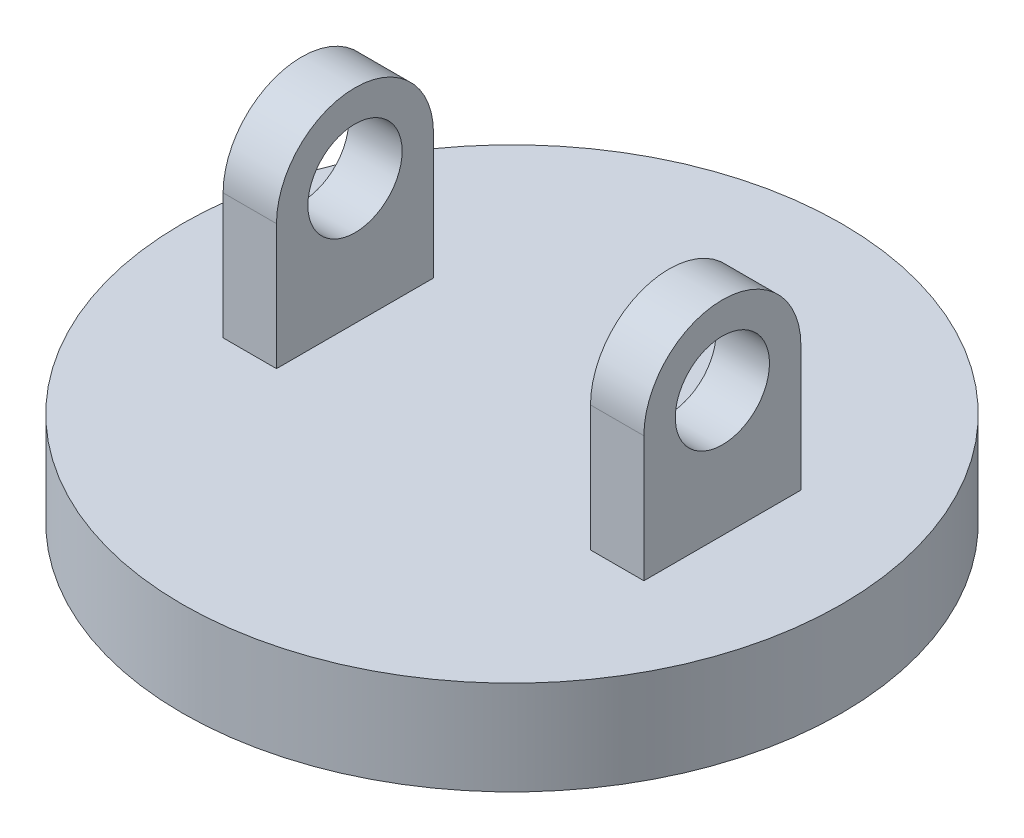
from build123d import *

# Parameters (mm, degrees)
SKETCH3_R           = 266.7
BOSS_EXTRUDE1_DEPTH = 76.2
SKETCH4_R           = 241.3
SKETCH4_R_2         = 215.9
CUT_EXTRUDE1_DEPTH  = 25.4
SKETCH5_R           = 254
SKETCH5_R_2         = 203.2
CUT_EXTRUDE2_DEPTH  = 25.4
SKETCH6_W           = 43.18
SKETCH6_H           = 127
BOSS_EXTRUDE2_DEPTH = 101.6
BOSS_EXTRUDE3_START = -43.18
BOSS_EXTRUDE3_DEPTH = 43.18
BOSS_EXTRUDE4_DEPTH = 43.18
SKETCH7_R           = 38.1
CUT_EXTRUDE3_DEPTH  = 566.878709972


with BuildPart() as part:
    # Sketch3 → Boss-Extrude1 (new body)
    with BuildSketch(Plane(origin=(0, 0, 0), x_dir=(1, 0, 0), z_dir=(0, 1, 0))):
        with Locations(Location((0, 0, 0), (0, 0, 90))):
            Circle(SKETCH3_R)
    extrude(amount=BOSS_EXTRUDE1_DEPTH)

    # Sketch4 → Cut-Extrude1 (cut)
    with BuildSketch(Plane.XZ):
        with Locations(Location((0, 0, 0), (0, 0, 270))):
            Circle(SKETCH4_R)
        with Locations(Location((0, 0, 0), (0, 0, 270))):
            Circle(SKETCH4_R_2, mode=Mode.SUBTRACT)
    extrude(amount=-CUT_EXTRUDE1_DEPTH, mode=Mode.SUBTRACT)

    # Sketch5 → Cut-Extrude2 (cut)
    with BuildSketch(Plane.XZ.offset(-25.4)):
        with Locations(Location((0, 0, 0), (0, 0, 270))):
            Circle(SKETCH5_R)
        with Locations(Location((0, 0, 0), (0, 0, 270))):
            Circle(SKETCH5_R_2, mode=Mode.SUBTRACT)
    extrude(amount=-CUT_EXTRUDE2_DEPTH, mode=Mode.SUBTRACT)

    # Sketch6 → Boss-Extrude2 (add)
    with BuildSketch(Plane(origin=(0, 76.2, 0), x_dir=(1, 0, 0), z_dir=(0, 1, 0))):
        with Locations((148.59, 0)):
            Rectangle(SKETCH6_W, SKETCH6_H)
        with Locations((-148.59, 0)):
            Rectangle(SKETCH6_W, SKETCH6_H)
    extrude(amount=BOSS_EXTRUDE2_DEPTH)

    # Sketch8 → Boss-Extrude3 (add)
    with BuildSketch(Plane.ZY.offset(170.18).offset(BOSS_EXTRUDE3_START)):
        with BuildLine():
            Line((-63.5, 177.8), (63.5, 177.8))
            ThreePointArc((63.5, 177.8), (0, 241.3), (-63.5, 177.8))
        make_face()
    extrude(amount=BOSS_EXTRUDE3_DEPTH)

    # Sketch10 → Boss-Extrude4 (add)
    with BuildSketch(Plane(origin=(170.18, 0, 0), x_dir=(0, 0, -1), z_dir=(1, 0, 0))):
        with BuildLine():
            Line((63.5, 177.8), (-63.5, 177.8))
            ThreePointArc((-63.5, 177.8), (0, 241.3), (63.5, 177.8))
        make_face()
    extrude(amount=-BOSS_EXTRUDE4_DEPTH)

    # Sketch7 → Cut-Extrude3 (cut, through all)
    with BuildSketch(Plane(origin=(170.18, 0, 0), x_dir=(0, 0, -1), z_dir=(1, 0, 0))):
        with Locations((0, 177.8)):
            Circle(SKETCH7_R)
    extrude(amount=-CUT_EXTRUDE3_DEPTH, mode=Mode.SUBTRACT)


solid = part.part
